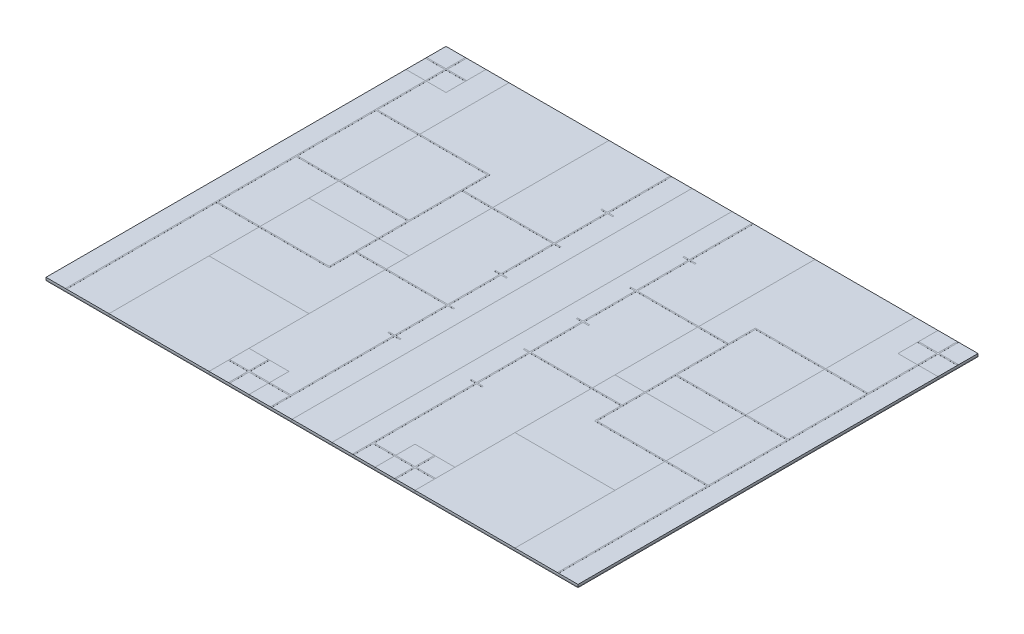
from build123d import *

# Parameters (mm, degrees)
SKETCH1_W              = 13300
SKETCH1_H              = 10000
BOSS_EXTRUDE1_DEPTH    = 20
SKETCH3_W              = 1575
SKETCH3_H              = 10000
BOSS_EXTRUDE2_DEPTH    = 50
SKETCH7_W              = 2500
SKETCH7_H              = 2500
BOSS_EXTRUDE7_DEPTH    = 50
SKETCH8_W              = 2500
SKETCH8_H              = 2500
BOSS_EXTRUDE8_DEPTH    = 50
SKETCH9_W              = 2500
SKETCH9_H              = 5000
BOSS_EXTRUDE9_DEPTH    = 50
SKETCH10_W             = 2075
SKETCH10_H             = 10000
BOSS_EXTRUDE10_DEPTH   = 50
SKETCH11_W             = 1000
SKETCH11_H             = 10000
BOSS_EXTRUDE12_DEPTH   = 50
SKETCH12_W             = 2075
SKETCH12_H             = 10000
BOSS_EXTRUDE13_DEPTH   = 50
SKETCH13_W             = 2500
SKETCH13_H             = 5000
BOSS_EXTRUDE14_DEPTH   = 50
SKETCH14_W             = 2500
SKETCH14_H             = 2500
BOSS_EXTRUDE15_DEPTH   = 50
SKETCH15_W             = 2500
SKETCH15_H             = 2500
BOSS_EXTRUDE16_DEPTH   = 50
SKETCH16_W             = 1575
SKETCH16_H             = 10000
BOSS_EXTRUDE17_DEPTH   = 50
SKETCH17_W             = 1000
SKETCH17_H             = 1000
CUT_EXTRUDE1_DEPTH     = 50
SKETCH18_W             = 1000
SKETCH18_H             = 1000
BOSS_EXTRUDE19_DEPTH   = 50
SKETCH19_W             = 1000
SKETCH19_H             = 1000
CUT_EXTRUDE2_DEPTH     = 50
SKETCH20_W             = 1000
SKETCH20_H             = 1000
BOSS_EXTRUDE20_DEPTH   = 50
SKETCH21_W             = 1000
SKETCH21_H             = 1000
CUT_EXTRUDE3_DEPTH     = 50
SKETCH22_W             = 1000
SKETCH22_H             = 1000
BOSS_EXTRUDE21_DEPTH   = 50
SKETCH23_W             = 1000
SKETCH23_H             = 1000
CUT_EXTRUDE4_DEPTH     = 50
SKETCH24_W             = 1000
SKETCH24_H             = 1000
BOSS_EXTRUDE22_DEPTH   = 50
SKETCH25_W             = 2787
SKETCH25_H             = 1965
BOSS_EXTRUDE31_DEPTH   = 1
BOSS_EXTRUDE31_2_DEPTH = 1


with BuildPart() as part:
    # Sketch1 → Boss-Extrude1 (new body)
    with BuildSketch(Plane(origin=(0, 0, 0), x_dir=(1, 0, 0), z_dir=(0, 1, 0))):
        Rectangle(SKETCH1_W, SKETCH1_H)
    extrude(amount=BOSS_EXTRUDE1_DEPTH)


with BuildPart() as body_2:
    # Sketch3 → Boss-Extrude2 (new body)
    with BuildSketch(Plane(origin=(0, 20, 0), x_dir=(1, 0, 0), z_dir=(0, 1, 0))):
        with Locations((-5862.5, 0)):
            Rectangle(SKETCH3_W, SKETCH3_H)
    extrude(amount=BOSS_EXTRUDE2_DEPTH)

    # Sketch17 → Cut-Extrude1 (cut)
    with BuildSketch(Plane(origin=(0, 70, 0), x_dir=(1, 0, 0), z_dir=(0, 1, 0))):
        with Locations((-6150, 4500)):
            Rectangle(SKETCH17_W, SKETCH17_H)
    extrude(amount=-CUT_EXTRUDE1_DEPTH, mode=Mode.SUBTRACT)


with BuildPart() as body_3:
    # Sketch7 → Boss-Extrude7 (new body)
    with BuildSketch(Plane(origin=(0, 20, 0), x_dir=(1, 0, 0), z_dir=(0, 1, 0))):
        with Locations((-3825, -3750)):
            Rectangle(SKETCH7_W, SKETCH7_H)
    extrude(amount=BOSS_EXTRUDE7_DEPTH)


with BuildPart() as body_4:
    # Sketch8 → Boss-Extrude8 (new body)
    with BuildSketch(Plane(origin=(0, 20, 0), x_dir=(1, 0, 0), z_dir=(0, 1, 0))):
        with Locations((-3825, -1250)):
            Rectangle(SKETCH8_W, SKETCH8_H)
    extrude(amount=BOSS_EXTRUDE8_DEPTH)


with BuildPart() as body_5:
    # Sketch9 → Boss-Extrude9 (new body)
    with BuildSketch(Plane(origin=(0, 20, 0), x_dir=(1, 0, 0), z_dir=(0, 1, 0))):
        with Locations((-3825, 2500)):
            Rectangle(SKETCH9_W, SKETCH9_H)
    extrude(amount=BOSS_EXTRUDE9_DEPTH)


with BuildPart() as body_6:
    # Sketch10 → Boss-Extrude10 (new body)
    with BuildSketch(Plane(origin=(0, 20, 0), x_dir=(1, 0, 0), z_dir=(0, 1, 0))):
        with Locations((-1537.5, 0)):
            Rectangle(SKETCH10_W, SKETCH10_H)
    extrude(amount=BOSS_EXTRUDE10_DEPTH)

    # Sketch19 → Cut-Extrude2 (cut)
    with BuildSketch(Plane(origin=(0, 70, 0), x_dir=(1, 0, 0), z_dir=(0, 1, 0))):
        with Locations((-2075, -4500)):
            Rectangle(SKETCH19_W, SKETCH19_H)
    extrude(amount=-CUT_EXTRUDE2_DEPTH, mode=Mode.SUBTRACT)


with BuildPart() as body_7:
    # Sketch11 → Boss-Extrude12 (new body)
    with BuildSketch(Plane(origin=(0, 20, 0), x_dir=(1, 0, 0), z_dir=(0, 1, 0))):
        Rectangle(SKETCH11_W, SKETCH11_H)
    extrude(amount=BOSS_EXTRUDE12_DEPTH)


with BuildPart() as body_8:
    # Sketch12 → Boss-Extrude13 (new body)
    with BuildSketch(Plane(origin=(0, 20, 0), x_dir=(1, 0, 0), z_dir=(0, 1, 0))):
        with Locations((1537.5, 0)):
            Rectangle(SKETCH12_W, SKETCH12_H)
    extrude(amount=BOSS_EXTRUDE13_DEPTH)

    # Sketch21 → Cut-Extrude3 (cut)
    with BuildSketch(Plane(origin=(0, 70, 0), x_dir=(1, 0, 0), z_dir=(0, 1, 0))):
        with Locations((2075, -4500)):
            Rectangle(SKETCH21_W, SKETCH21_H)
    extrude(amount=-CUT_EXTRUDE3_DEPTH, mode=Mode.SUBTRACT)


with BuildPart() as body_9:
    # Sketch13 → Boss-Extrude14 (new body)
    with BuildSketch(Plane(origin=(0, 20, 0), x_dir=(1, 0, 0), z_dir=(0, 1, 0))):
        with Locations((3825, 2500)):
            Rectangle(SKETCH13_W, SKETCH13_H)
    extrude(amount=BOSS_EXTRUDE14_DEPTH)


with BuildPart() as body_10:
    # Sketch14 → Boss-Extrude15 (new body)
    with BuildSketch(Plane(origin=(0, 20, 0), x_dir=(1, 0, 0), z_dir=(0, 1, 0))):
        with Locations((3825, -1250)):
            Rectangle(SKETCH14_W, SKETCH14_H)
    extrude(amount=BOSS_EXTRUDE15_DEPTH)


with BuildPart() as body_11:
    # Sketch15 → Boss-Extrude16 (new body)
    with BuildSketch(Plane(origin=(0, 20, 0), x_dir=(1, 0, 0), z_dir=(0, 1, 0))):
        with Locations((3825, -3750)):
            Rectangle(SKETCH15_W, SKETCH15_H)
    extrude(amount=BOSS_EXTRUDE16_DEPTH)


with BuildPart() as body_12:
    # Sketch16 → Boss-Extrude17 (new body)
    with BuildSketch(Plane(origin=(0, 20, 0), x_dir=(1, 0, 0), z_dir=(0, 1, 0))):
        with Locations((5862.5, 0)):
            Rectangle(SKETCH16_W, SKETCH16_H)
    extrude(amount=BOSS_EXTRUDE17_DEPTH)

    # Sketch23 → Cut-Extrude4 (cut)
    with BuildSketch(Plane(origin=(0, 70, 0), x_dir=(1, 0, 0), z_dir=(0, 1, 0))):
        with Locations((6150, 4500)):
            Rectangle(SKETCH23_W, SKETCH23_H)
    extrude(amount=-CUT_EXTRUDE4_DEPTH, mode=Mode.SUBTRACT)


with BuildPart() as body_13:
    # Sketch18 → Boss-Extrude19 (new body)
    with BuildSketch(Plane(origin=(0, 20, 0), x_dir=(1, 0, 0), z_dir=(0, 1, 0))):
        with Locations((-6150, 4500)):
            Rectangle(SKETCH18_W, SKETCH18_H)
    extrude(amount=BOSS_EXTRUDE19_DEPTH)


with BuildPart() as body_14:
    # Sketch20 → Boss-Extrude20 (new body)
    with BuildSketch(Plane(origin=(0, 20, 0), x_dir=(1, 0, 0), z_dir=(0, 1, 0))):
        with Locations((-2075, -4500)):
            Rectangle(SKETCH20_W, SKETCH20_H)
    extrude(amount=BOSS_EXTRUDE20_DEPTH)


with BuildPart() as body_15:
    # Sketch22 → Boss-Extrude21 (new body)
    with BuildSketch(Plane(origin=(0, 20, 0), x_dir=(1, 0, 0), z_dir=(0, 1, 0))):
        with Locations((2075, -4500)):
            Rectangle(SKETCH22_W, SKETCH22_H)
    extrude(amount=BOSS_EXTRUDE21_DEPTH)


with BuildPart() as body_16:
    # Sketch24 → Boss-Extrude22 (new body)
    with BuildSketch(Plane(origin=(0, 20, 0), x_dir=(1, 0, 0), z_dir=(0, 1, 0))):
        with Locations((6150, 4500)):
            Rectangle(SKETCH24_W, SKETCH24_H)
    extrude(amount=BOSS_EXTRUDE22_DEPTH)


with BuildPart() as body_17:
    # Sketch25 → Boss-Extrude31 (new body)
    with BuildSketch(Plane(origin=(0, 70, 0), x_dir=(1, 0, 0), z_dir=(0, 1, 0))):
        Polygon((-6135, 5000), (-6165, 5000), (-6165, 4515), (-6650, 4515), (-6650, 4485), (-6165, 4485), (-6165, -5000), (-6135, -5000), (-6135, -1253), (-3318, -1253), (-3318, -1223), (-3318, -595), (-1040, -595), (-1040, -1895), (-1175, -1895), (-1175, -1925), (-1040, -1925), (-1040, -4485), (-2060, -4485), (-2060, -4000), (-2090, -4000), (-2090, -4485), (-2575, -4485), (-2575, -4515), (-2090, -4515), (-2090, -5000), (-2060, -5000), (-2060, -4515), (-1040, -4515), (-1040, -5000), (-1010, -5000), (-1010, -1925), (-875, -1925), (-875, -1895), (-1010, -1895), (-1010, -595), (-875, -595), (-875, -565), (-1010, -565), (-1010, 735), (-875, 735), (-875, 765), (-1010, 765), (-1010, 2065), (-875, 2065), (-875, 2095), (-1010, 2095), (-1010, 3395), (-875, 3395), (-875, 3425), (-1010, 3425), (-1010, 5000), (-1040, 5000), (-1040, 3425), (-1175, 3425), (-1175, 3395), (-1040, 3395), (-1040, 2095), (-3318, 2095), (-3318, 2737), (-3318, 2767), (-6135, 2767), (-6135, 4485), (-5650, 4485), (-5650, 4515), (-6135, 4515), align=None)
        with Locations((-4741.5, 1754.5)):
            Rectangle(SKETCH25_W, SKETCH25_H, mode=Mode.SUBTRACT)
        with Locations((-4741.5, -240.5)):
            Rectangle(SKETCH25_W, SKETCH25_H, mode=Mode.SUBTRACT)
        Polygon((-1040, -565), (-3318, -565), (-3318, 2065), (-1040, 2065), (-1040, 765), (-1175, 765), (-1175, 735), (-1040, 735), align=None, mode=Mode.SUBTRACT)
    extrude(amount=BOSS_EXTRUDE31_DEPTH)


with BuildPart() as body_18:
    # Sketch25 → Boss-Extrude31 2 (new body)
    with BuildSketch(Plane(origin=(0, 70, 0), x_dir=(1, 0, 0), z_dir=(0, 1, 0))):
        Polygon((1010, 2095), (1010, 3395), (875, 3395), (875, 3425), (1010, 3425), (1010, 5000), (1040, 5000), (1040, 3425), (1175, 3425), (1175, 3395), (1040, 3395), (1040, 2095), (3318, 2095), (3318, 2737), (3318, 2767), (6135, 2767), (6135, 4485), (5650, 4485), (5650, 4515), (6135, 4515), (6135, 5000), (6165, 5000), (6165, 4515), (6650, 4515), (6650, 4485), (6165, 4485), (6165, -5000), (6135, -5000), (6135, -1253), (3318, -1253), (3318, -1223), (3318, -595), (1040, -595), (1040, -1895), (1175, -1895), (1175, -1925), (1040, -1925), (1040, -4485), (2060, -4485), (2060, -4000), (2090, -4000), (2090, -4485), (2575, -4485), (2575, -4515), (2090, -4515), (2090, -5000), (2060, -5000), (2060, -4515), (1040, -4515), (1040, -5000), (1010, -5000), (1010, -1925), (875, -1925), (875, -1895), (1010, -1895), (1010, -595), (875, -595), (875, -565), (1010, -565), (1010, 735), (875, 735), (875, 765), (1010, 765), (1010, 2065), (875, 2065), (875, 2095), align=None)
        Polygon((3318, 2065), (3318, -565), (1040, -565), (1040, 735), (1175, 735), (1175, 765), (1040, 765), (1040, 2065), align=None, mode=Mode.SUBTRACT)
        with Locations((4741.5, -240.5)):
            Rectangle(SKETCH25_W, SKETCH25_H, mode=Mode.SUBTRACT)
        with Locations((4741.5, 1754.5)):
            Rectangle(SKETCH25_W, SKETCH25_H, mode=Mode.SUBTRACT)
    extrude(amount=BOSS_EXTRUDE31_2_DEPTH)


solid = Compound([part.part, body_2.part, body_3.part, body_4.part, body_5.part, body_6.part, body_7.part, body_8.part, body_9.part, body_10.part, body_11.part, body_12.part, body_13.part, body_14.part, body_15.part, body_16.part, body_17.part, body_18.part])
